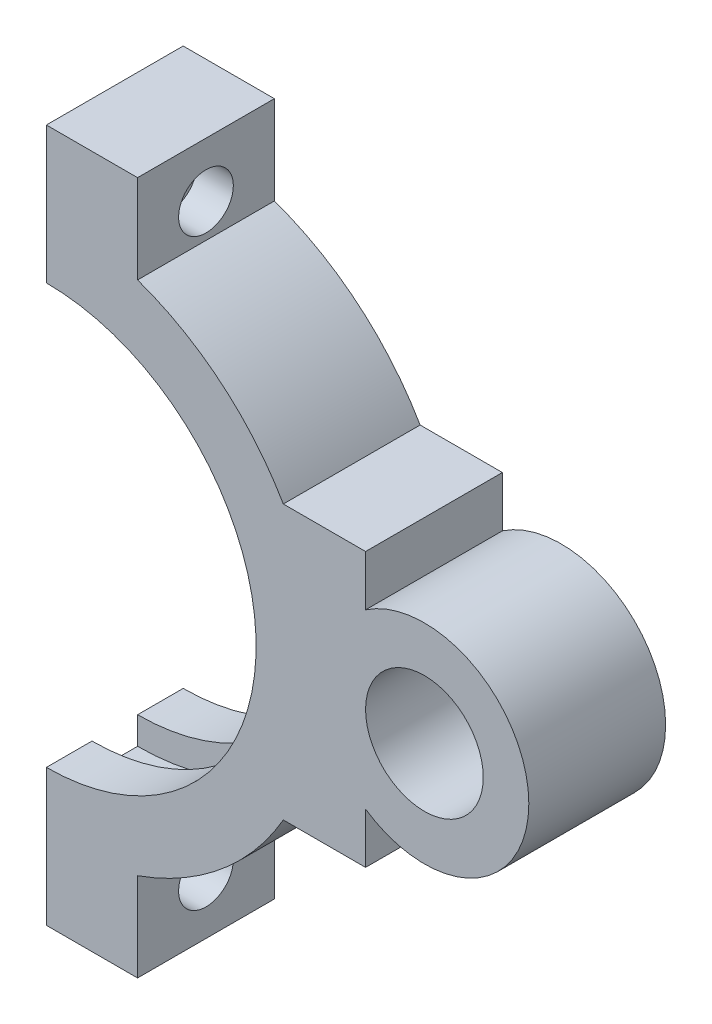
from build123d import *
from build123d.topology import SkipClean

# Parameters (mm, degrees)
BOSS_EXTRUDE1_DEPTH = 5
SKETCH2_R           = 6.45
BOSS_EXTRUDE2_DEPTH = 5
BOSS_EXTRUDE4_START = 5
SKETCH3_R           = 6.45
BOSS_EXTRUDE4_DEPTH = 5
SKETCH7_R           = 1.6
CUT_EXTRUDE1_DEPTH  = 15
SKETCH9_R           = 3
CUT_EXTRUDE3_DEPTH  = 4


with BuildPart() as part:
    # Sketch1 → Boss-Extrude1 (new body)
    with BuildSketch(Plane.XY):
        with BuildLine():
            Line((0, 26.485074627), (0, 30.485074627))
            Line((0, 30.485074627), (0, 38.485074627))
            Line((0, 38.485074627), (10, 38.485074627))
            Line((10, 38.485074627), (10, 28.769345874))
            ThreePointArc((10, 28.769345874), (19.177376677, 23.555146664), (25.980762114, 15.485074627))
            Line((25.980762114, 15.485074627), (35, 15.485074627))
            Line((35, 15.485074627), (35, 9.945518591))
            ThreePointArc((35, 9.945518591), (52.9, 0.485074627), (35, -8.975369337))
            Line((35, -8.975369337), (35, -14.514925373))
            Line((35, -14.514925373), (25.980762114, -14.514925373))
            ThreePointArc((25.980762114, -14.514925373), (19.177376677, -22.58499741), (10, -27.799196621))
            Line((10, -27.799196621), (10, -37.514925373))
            Line((10, -37.514925373), (0, -37.514925373))
            Line((0, -37.514925373), (0, -29.514925373))
            Line((0, -29.514925373), (0, -25.514925373))
            ThreePointArc((0, -25.514925373), (26, 0.485074627), (0, 26.485074627))
        make_face()
        with BuildLine():
            ThreePointArc((41.45, 6.935074627), (35, 0.485074627), (41.45, -5.964925373))
            ThreePointArc((41.45, -5.964925373), (47.9, 0.485074627), (41.45, 6.935074627))
        make_face(mode=Mode.SUBTRACT)
    extrude(amount=BOSS_EXTRUDE1_DEPTH)

    # Sketch2 → Boss-Extrude2 (add)
    with SkipClean():  # the faces are left unmerged after this step: merging them gives an invalid solid
        with BuildSketch(Plane.XY.offset(5)):
            with BuildLine():
                Line((0, 26.485074627), (0, 23.485074627))
                ThreePointArc((0, 23.485074627), (23, 0.485074627), (0, -22.514925373))
                Line((0, -22.514925373), (0, -25.514925373))
                Line((0, -25.514925373), (0, -29.514925373))
                Line((0, -29.514925373), (0, -37.514925373))
                Line((0, -37.514925373), (10, -37.514925373))
                Line((10, -37.514925373), (10, -27.799196621))
                ThreePointArc((10, -27.799196621), (19.177376677, -22.58499741), (25.980762114, -14.514925373))
                Line((25.980762114, -14.514925373), (35, -14.514925373))
                Line((35, -14.514925373), (35, -8.975369337))
                ThreePointArc((35, -8.975369337), (52.9, 0.485074627), (35, 9.945518591))
                Line((35, 9.945518591), (35, 15.485074627))
                Line((35, 15.485074627), (25.980762114, 15.485074627))
                ThreePointArc((25.980762114, 15.485074627), (19.177376677, 23.555146664), (10, 28.769345874))
                Line((10, 28.769345874), (10, 38.485074627))
                Line((10, 38.485074627), (0, 38.485074627))
                Line((0, 38.485074627), (0, 30.485074627))
                Line((0, 30.485074627), (0, 26.485074627))
            make_face()
            with Locations((41.45, 0.485074627)):
                Circle(SKETCH2_R, mode=Mode.SUBTRACT)
        extrude(amount=BOSS_EXTRUDE2_DEPTH)

    # Sketch3 → Boss-Extrude4 (add)
    with SkipClean():  # the faces are left unmerged after this step: merging them gives an invalid solid
        with BuildSketch(Plane(origin=(0, 0, 0), x_dir=(-1, 0, 0), z_dir=(0, 0, -1)).offset(BOSS_EXTRUDE4_START)):
            with BuildLine():
                Line((0, -22.514925373), (0, -29.514925373))
                Line((0, -29.514925373), (0, -37.514925373))
                Line((0, -37.514925373), (-10, -37.514925373))
                Line((-10, -37.514925373), (-10, -27.799196621))
                ThreePointArc((-10, -27.799196621), (-19.177376677, -22.58499741), (-25.980762114, -14.514925373))
                Line((-25.980762114, -14.514925373), (-35, -14.514925373))
                Line((-35, -14.514925373), (-35, -8.975369337))
                ThreePointArc((-35, -8.975369337), (-52.9, 0.485074627), (-35, 9.945518591))
                Line((-35, 9.945518591), (-35, 15.485074627))
                Line((-35, 15.485074627), (-25.980762114, 15.485074627))
                ThreePointArc((-25.980762114, 15.485074627), (-19.177376677, 23.555146664), (-10, 28.769345874))
                Line((-10, 28.769345874), (-10, 38.485074627))
                Line((-10, 38.485074627), (0, 38.485074627))
                Line((0, 38.485074627), (0, 30.485074627))
                Line((0, 30.485074627), (0, 23.485074627))
                ThreePointArc((0, 23.485074627), (-23, 0.485074627), (0, -22.514925373))
            make_face()
            with Locations((-41.45, 0.485074627)):
                Circle(SKETCH3_R, mode=Mode.SUBTRACT)
        extrude(amount=-BOSS_EXTRUDE4_DEPTH)

    # Sketch7 → Cut-Extrude1 (cut)
    with SkipClean():  # the faces are left unmerged after this step: merging them gives an invalid solid
        with BuildSketch(Plane.ZY):
            with Locations((2.5, 32.485074627)):
                Circle(SKETCH7_R)
            with Locations((2.5, -31.514925373)):
                Circle(SKETCH7_R)
        extrude(amount=-CUT_EXTRUDE1_DEPTH, mode=Mode.SUBTRACT)

    # Sketch9 → Cut-Extrude3 (cut)
    with SkipClean():  # the faces are left unmerged after this step: merging them gives an invalid solid
        with BuildSketch(Plane(origin=(10, 0, 0), x_dir=(0, 0, -1), z_dir=(1, 0, 0))):
            with Locations((-2.5, -31.514925373)):
                Circle(SKETCH9_R)
            with Locations((-2.5, 32.485074627)):
                Circle(SKETCH9_R)
        extrude(amount=-CUT_EXTRUDE3_DEPTH, mode=Mode.SUBTRACT)


solid = part.part
